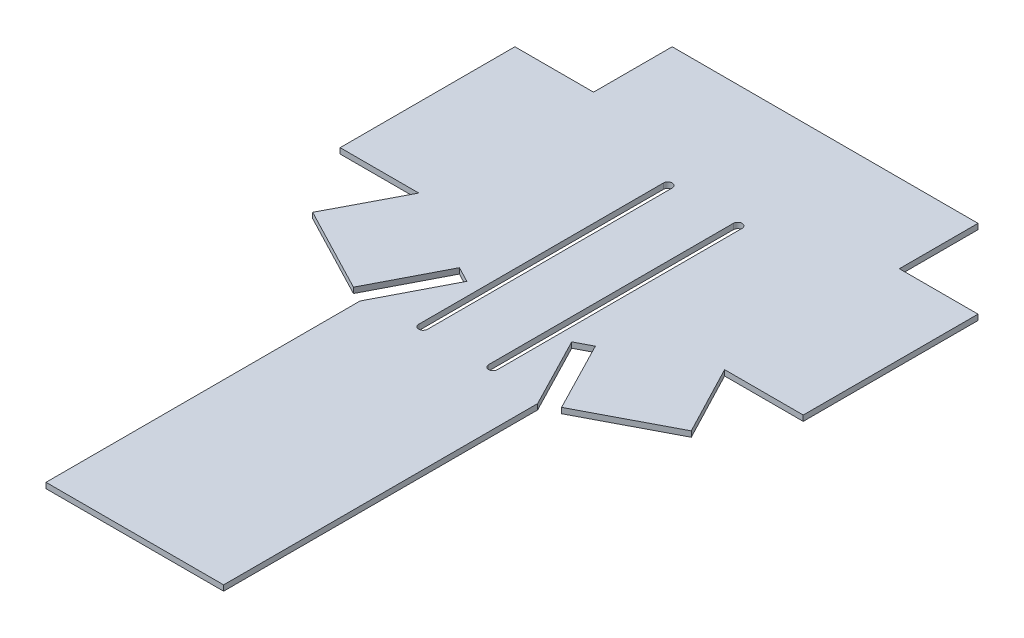
from build123d import *

# Parameters (mm, degrees)
BASE_DEPTH          = 3.175
SKETCH2_W           = 175
SKETCH2_H           = 45
BOSS_EXTRUDE2_DEPTH = 3.175
SKETCH3_W           = 45
SKETCH3_H           = 100
BOSS_EXTRUDE3_DEPTH = 3.175
CUT_EXTRUDE1_DEPTH  = 375.254366207


with BuildPart() as part:
    # Sketch1 → Base (new body)
    with BuildSketch(Plane(origin=(0, 0, 0), x_dir=(1, 0, 0), z_dir=(0, 1, 0))):
        Polygon((87.5, 0), (-87.5, 0), (-87.5, -100), (-30, -130), (-30, -350), (30, -350), (30, -130), (87.5, -100), align=None)
    extrude(amount=BASE_DEPTH)

    # Sketch2 → Boss-Extrude2 (add)
    with BuildSketch(Plane(origin=(0, 0, 0), x_dir=(1, 0, 0), z_dir=(0, 1, 0))):
        with Locations((0, 22.5)):
            Rectangle(SKETCH2_W, SKETCH2_H)
        Polygon((-108.315470301, -139.896318077), (-87.5, -100), (-38.733948559, -125.03895229), (-59.553303762, -165.337448446), align=None)
        Polygon((108.315470301, -139.896318077), (59.553303762, -165.337448446), (38.733948559, -125.03895229), (87.5, -100), align=None)
        Polygon((-30, -130), (-50.819355203, -170.298496155), (-50.819355203, -350), (-30, -350), align=None)
        Polygon((50.819355203, -170.298496155), (50.819355203, -350), (30, -350), (30, -130), align=None)
    extrude(amount=BOSS_EXTRUDE2_DEPTH)

    # Sketch3 → Boss-Extrude3 (add)
    with BuildSketch(Plane(origin=(0, 0, 0), x_dir=(1, 0, 0), z_dir=(0, 1, 0))):
        with Locations((-110, -50)):
            Rectangle(SKETCH3_W, SKETCH3_H)
        with Locations((110, -50)):
            Rectangle(SKETCH3_W, SKETCH3_H)
    extrude(amount=BOSS_EXTRUDE3_DEPTH)

    # Sketch4 → Cut-Extrude1 (cut, through all)
    with BuildSketch(Plane(origin=(0, 3.175, 0), x_dir=(1, 0, 0), z_dir=(0, 1, 0))):
        with BuildLine():
            Line((-17.5, -25), (-17.5, -165))
            ThreePointArc((-17.5, -165), (-20, -167.5), (-22.5, -165))
            Line((-22.5, -165), (-22.5, -25))
            ThreePointArc((-22.5, -25), (-20, -22.5), (-17.5, -25))
        make_face()
        with BuildLine():
            Line((17.5, -25), (17.5, -165))
            ThreePointArc((17.5, -165), (20, -167.5), (22.5, -165))
            Line((22.5, -165), (22.5, -25))
            ThreePointArc((22.5, -25), (20, -22.5), (17.5, -25))
        make_face()
    extrude(amount=-CUT_EXTRUDE1_DEPTH, mode=Mode.SUBTRACT)


solid = part.part
